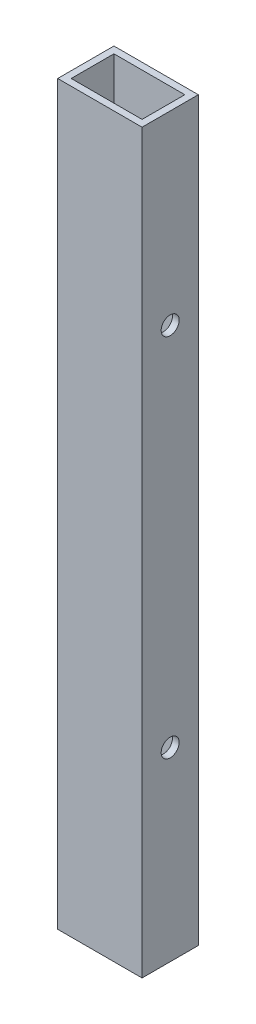
from build123d import *

# Parameters (mm, degrees)
SKETCH_1_W          = 15
SKETCH_1_H          = 10
SKETCH_1_W_2        = 12.6
SKETCH_1_H_2        = 7.6
EXTRUDE_1_DEPTH     = 65.5
SKETCH_2_R          = 1.6
CUT_EXTRUDE_1_DEPTH = 65.5


with BuildPart() as part:
    # ｽｹｯﾁ1 → ﾎﾞｽ - 押し出し1 (new, symmetric)
    with BuildSketch(Plane(origin=(0, 0, 0), x_dir=(1, 0, 0), z_dir=(0, 1, 0))):
        Rectangle(SKETCH_1_W, SKETCH_1_H)
        Rectangle(SKETCH_1_W_2, SKETCH_1_H_2, mode=Mode.SUBTRACT)
    extrude(amount=EXTRUDE_1_DEPTH, both=True)

    # ｽｹｯﾁ2 → ｶｯﾄ - 押し出し1 (cut, symmetric)
    with BuildSketch(Plane.ZY.offset(7.5)):
        with Locations((0, 32.5)):
            Circle(SKETCH_2_R)
    cut_extrude_1 = extrude(amount=CUT_EXTRUDE_1_DEPTH, both=True, mode=Mode.SUBTRACT)

    # ﾐﾗｰ1: ｶｯﾄ - 押し出し1 across plane
    add(cut_extrude_1.mirror(Plane.ZX), mode=Mode.SUBTRACT)


solid = part.part
